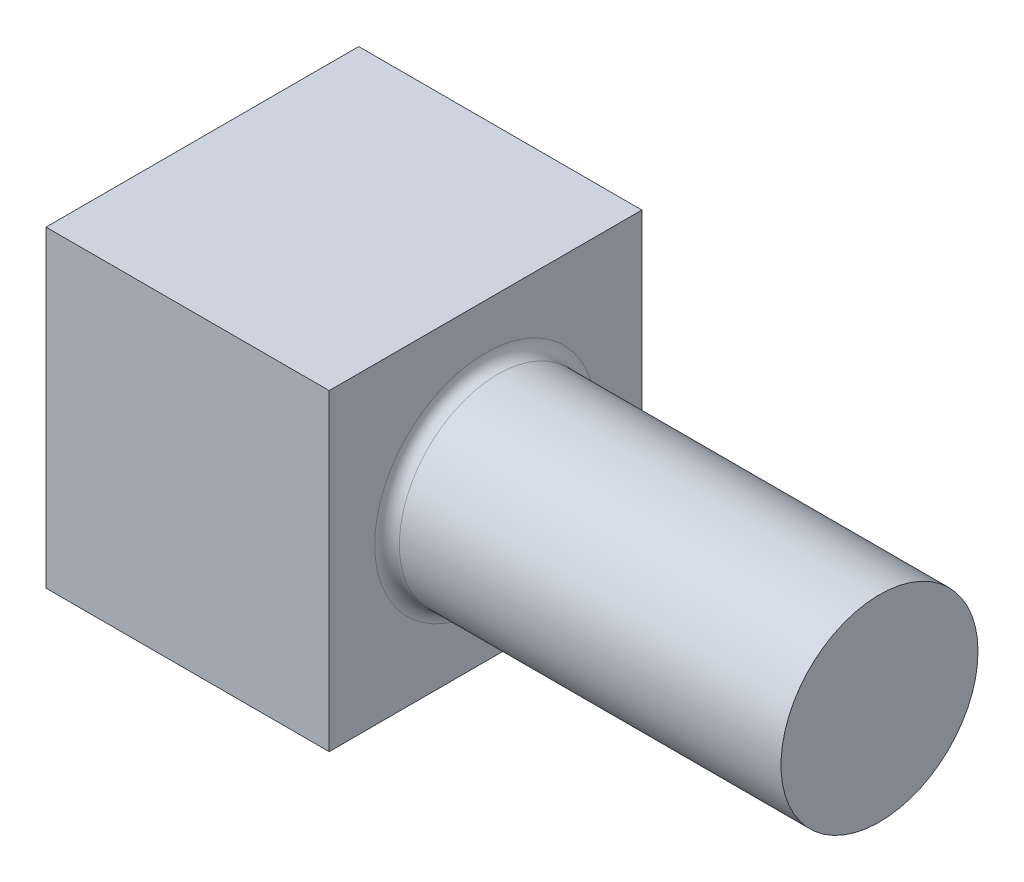
from build123d import *

# Parameters (mm, degrees)
SKETCH1_W           = 12.7
SKETCH1_H           = 12.7
BOSS_EXTRUDE1_DEPTH = 12
SKETCH2_R           = 4
BOSS_EXTRUDE2_DEPTH = 16
FILLET1_R           = 0.5
CHAMFER2_SIZE       = 0.5


with BuildPart() as part:
    # Sketch1 → Boss-Extrude1 (new body)
    with BuildSketch(Plane(origin=(0, 0, 0), x_dir=(0, 0, -1), z_dir=(1, 0, 0))):
        Rectangle(SKETCH1_W, SKETCH1_H)
    extrude(amount=BOSS_EXTRUDE1_DEPTH)

    # Sketch2 → Boss-Extrude2 (add)
    with BuildSketch(Plane(origin=(12, 0, 0), x_dir=(0, 0, -1), z_dir=(1, 0, 0))):
        Circle(SKETCH2_R)
    extrude(amount=BOSS_EXTRUDE2_DEPTH)

    # Fillet1
    fillet1_edges = [part.edges().sort_by_distance(p)[0] for p in [
        (12, 0, 4),
    ]]
    fillet(fillet1_edges, radius=FILLET1_R)

    # Chamfer2
    chamfer2_edges = [part.edges().sort_by_distance(p)[0] for p in [
        (0, 6.35, 0),
        (0, 0, -6.35),
        (0, -6.35, 0),
        (0, 0, 6.35),
    ]]
    chamfer(chamfer2_edges, length=CHAMFER2_SIZE)


solid = part.part
